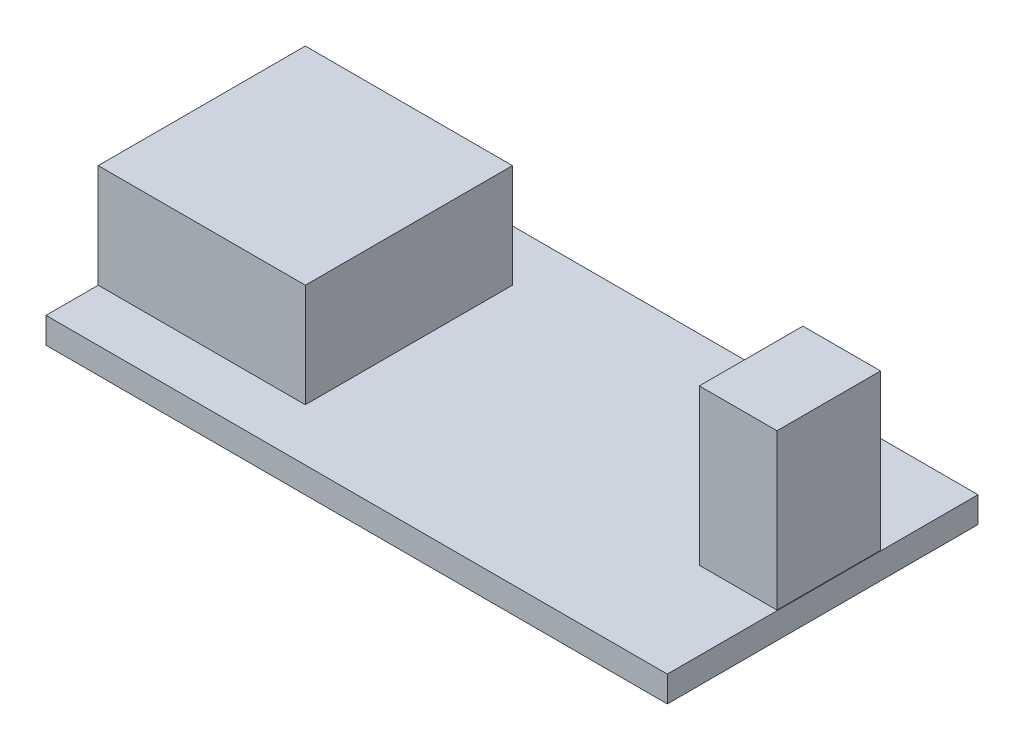
from build123d import *

# Parameters (mm, degrees)
SKETCH1_W           = 304.8
SKETCH1_H           = 152.4
BOSS_EXTRUDE1_DEPTH = 12.7
SKETCH2_W           = 38.1
SKETCH2_H           = 50.8
BOSS_EXTRUDE2_DEPTH = 76.2
SKETCH3_W           = 101.6
SKETCH3_H           = 101.6
BOSS_EXTRUDE3_DEPTH = 50.8


with BuildPart() as part:
    # Sketch1 → Boss-Extrude1 (new body)
    with BuildSketch(Plane(origin=(0, 0, 0), x_dir=(1, 0, 0), z_dir=(0, 1, 0))):
        Rectangle(SKETCH1_W, SKETCH1_H)
    extrude(amount=BOSS_EXTRUDE1_DEPTH)

    # Sketch2 → Boss-Extrude2 (add)
    with BuildSketch(Plane(origin=(0, 12.7, 0), x_dir=(1, 0, 0), z_dir=(0, 1, 0))):
        with Locations((133.070932654, 3.267194716)):
            Rectangle(SKETCH2_W, SKETCH2_H)
    extrude(amount=BOSS_EXTRUDE2_DEPTH)

    # Sketch3 → Boss-Extrude3 (add)
    with BuildSketch(Plane(origin=(0, 12.7, 0), x_dir=(1, 0, 0), z_dir=(0, 1, 0))):
        with Locations((-101.6, 0.217888901)):
            Rectangle(SKETCH3_W, SKETCH3_H)
    extrude(amount=BOSS_EXTRUDE3_DEPTH)


solid = part.part
